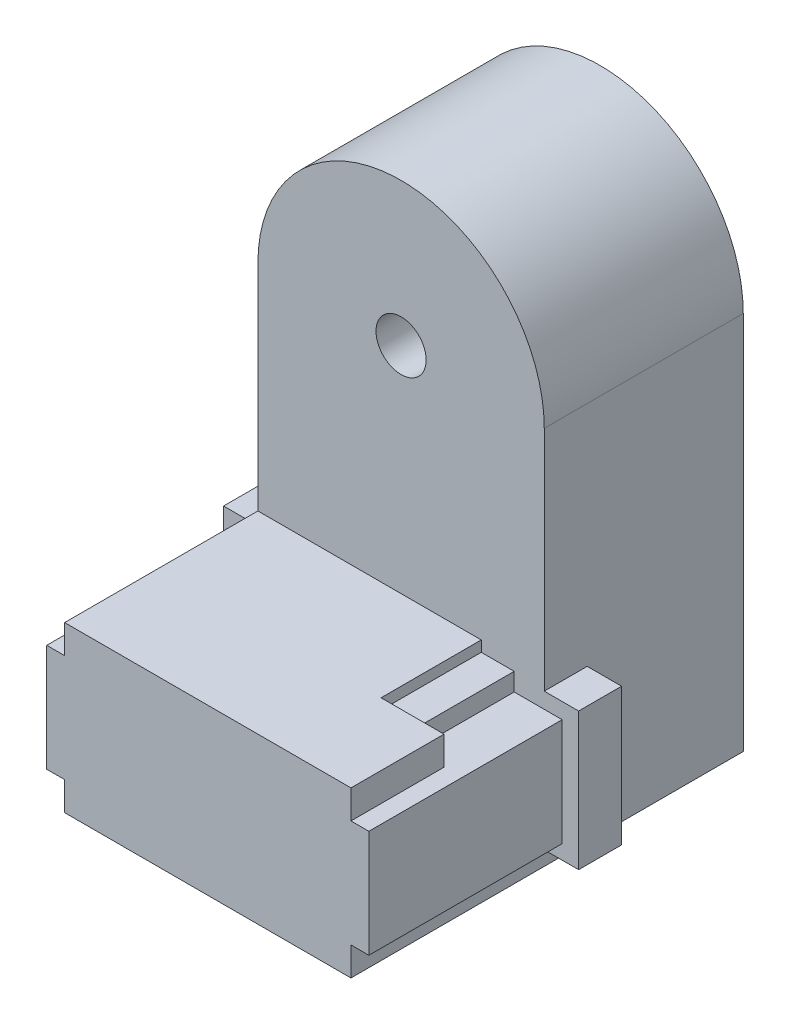
from build123d import *

# Parameters (mm, degrees)
BOSS_EXTRUDE1_DEPTH = 13.9
SKETCH2_W           = 20
SKETCH2_H           = 11.5
BOSS_EXTRUDE2_DEPTH = 13.5
SKETCH4_W           = 24.8
SKETCH4_H           = 9.6
BOSS_EXTRUDE3_DEPTH = 3
BOSS_EXTRUDE4_START = -13.5
SKETCH5_W           = 22.5
SKETCH5_H           = 7.5
BOSS_EXTRUDE4_DEPTH = 13.5
CUT_EXTRUDE1_DEPTH  = 7
SKETCH7_R           = 1.75
CUT_EXTRUDE2_DEPTH  = 13.9


with BuildPart() as part:
    # Sketch1 → Boss-Extrude1 (new body)
    with BuildSketch(Plane.XY):
        with BuildLine():
            Line((0, 0), (20, 0))
            Line((20, 0), (20, 26.5))
            ThreePointArc((20, 26.5), (10, 36.5), (0, 26.5))
            Line((0, 26.5), (0, 0))
        make_face()
    extrude(amount=BOSS_EXTRUDE1_DEPTH)

    # Sketch2 → Boss-Extrude2 (add)
    with BuildSketch(Plane.XY.offset(13.9)):
        with Locations((10, 5.75)):
            Rectangle(SKETCH2_W, SKETCH2_H)
    extrude(amount=BOSS_EXTRUDE2_DEPTH)

    # Sketch4 → Boss-Extrude3 (add)
    with BuildSketch(Plane.XY.offset(13.9)):
        with Locations((10, 5.8)):
            Rectangle(SKETCH4_W, SKETCH4_H)
    extrude(amount=-BOSS_EXTRUDE3_DEPTH)

    # Sketch5 → Boss-Extrude4 (add)
    with BuildSketch(Plane.XY.offset(27.4).offset(BOSS_EXTRUDE4_START)):
        with Locations((10, 5.75)):
            Rectangle(SKETCH5_W, SKETCH5_H)
    extrude(amount=BOSS_EXTRUDE4_DEPTH)

    # Sketch6 → Cut-Extrude1 (cut)
    with BuildSketch(Plane.XY.offset(13.9)):
        Polygon((20, 11.5), (15.6, 11.5), (15.6, 10.75), (17.9, 10.75), (17.9, 9.5), (20, 9.5), align=None)
        Polygon((0, 0), (0, 2), (2.1, 2), (2.1, 0.75), (4.4, 0.75), (4.4, 0), align=None)
    extrude(amount=CUT_EXTRUDE1_DEPTH, mode=Mode.SUBTRACT)

    # Sketch7 → Cut-Extrude2 (cut)
    with BuildSketch(Plane(origin=(0, 0, 0), x_dir=(-1, 0, 0), z_dir=(0, 0, -1))):
        with Locations((-10, 26.5)):
            Circle(SKETCH7_R)
    extrude(amount=-CUT_EXTRUDE2_DEPTH, mode=Mode.SUBTRACT)


solid = part.part
